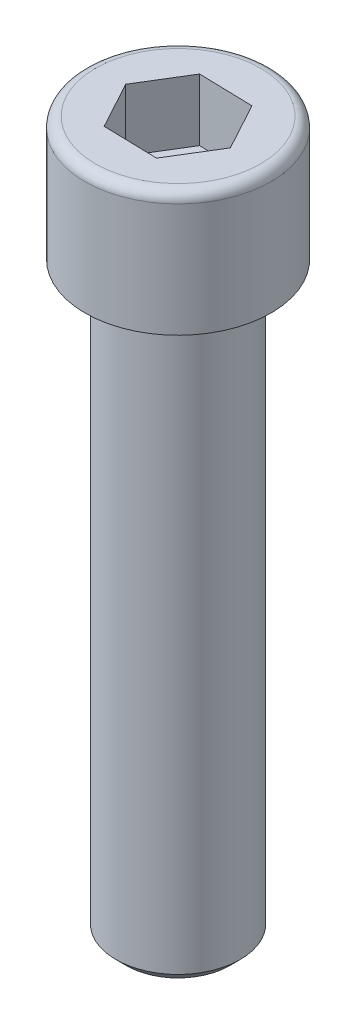
from build123d import *

# Parameters (mm, degrees)
DIAMETRE_TETE_R     = 27
HAUTEUR_TETE_DEPTH  = 36
CONGE_R             = 3
DIAMETRE_R          = 18
LONGUEUR_DEPTH      = 170
HAUTEUR_6PANS_DEPTH = 18
CHANFREIN_SIZE      = 3


with BuildPart() as part:
    # DIAMETRE_TETE → HAUTEUR_TETE (new body)
    with BuildSketch(Plane(origin=(0, 0, 0), x_dir=(1, 0, 0), z_dir=(0, 1, 0))):
        with Locations(Location((0, 0, 0), (0, 0, 270))):
            Circle(DIAMETRE_TETE_R)
    extrude(amount=HAUTEUR_TETE_DEPTH)

    # CONGE
    conge_edges = [part.edges().sort_by_distance(p)[0] for p in [
        (0, 36, -27),
    ]]
    fillet(conge_edges, radius=CONGE_R)

    # DIAMETRE → LONGUEUR (add)
    with BuildSketch(Plane.XZ):
        with Locations(Location((0, 0, 0), (0, 0, 270))):
            Circle(DIAMETRE_R)
    extrude(amount=LONGUEUR_DEPTH)

    # LARGEUR_6PANS → HAUTEUR_6PANS (cut)
    with BuildSketch(Plane(origin=(0, 36, 0), x_dir=(1, 0, 0), z_dir=(0, 1, 0))):
        Polygon((8.142672131, 13.292738265), (-7.440512958, 13.698130052), (-15.583185088, 0.405391788), (-8.142672131, -13.292738265), (7.440512958, -13.698130052), (15.583185088, -0.405391788), align=None)
    extrude(amount=-HAUTEUR_6PANS_DEPTH, mode=Mode.SUBTRACT)

    # CHANFREIN
    chanfrein_edges = [part.edges().sort_by_distance(p)[0] for p in [
        (0, -170, 18),
    ]]
    chamfer(chanfrein_edges, length=CHANFREIN_SIZE)


solid = part.part
